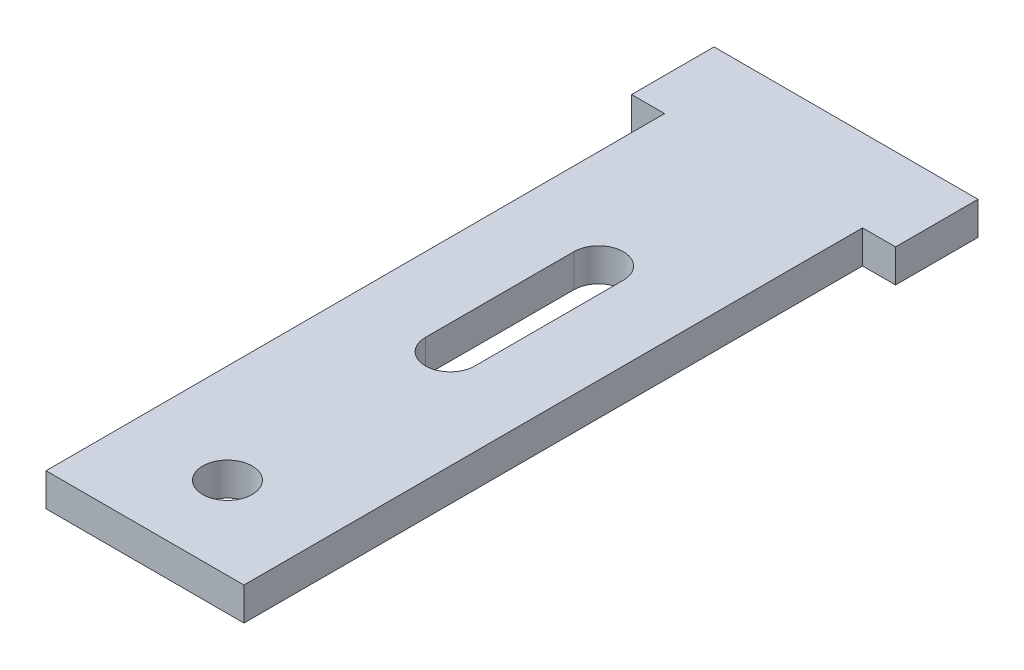
from build123d import *

# Parameters (mm, degrees)
SKETCH1_R           = 1.5
BOSS_EXTRUDE1_DEPTH = 2


with BuildPart() as part:
    # Sketch1 → Boss-Extrude1 (new body)
    with BuildSketch(Plane(origin=(0, 0, 0), x_dir=(1, 0, 0), z_dir=(0, 1, 0))):
        Polygon((-6, 21.735699927), (-8, 21.735699927), (-8, 26.735699927), (8, 26.735699927), (8, 21.735699927), (6, 21.735699927), (6, -15.764300073), (-6, -15.764300073), align=None)
        with Locations(Location((0, -10.764300073, 0), (0, 0, 270))):
            Circle(SKETCH1_R, mode=Mode.SUBTRACT)
        with BuildLine():
            Line((1.5, 2.735699927), (1.5, 11.735699927))
            ThreePointArc((1.5, 11.735699927), (0, 13.235699927), (-1.5, 11.735699927))
            Line((-1.5, 11.735699927), (-1.5, 2.735699927))
            ThreePointArc((-1.5, 2.735699927), (0, 1.235699927), (1.5, 2.735699927))
        make_face(mode=Mode.SUBTRACT)
    extrude(amount=BOSS_EXTRUDE1_DEPTH)


solid = part.part
